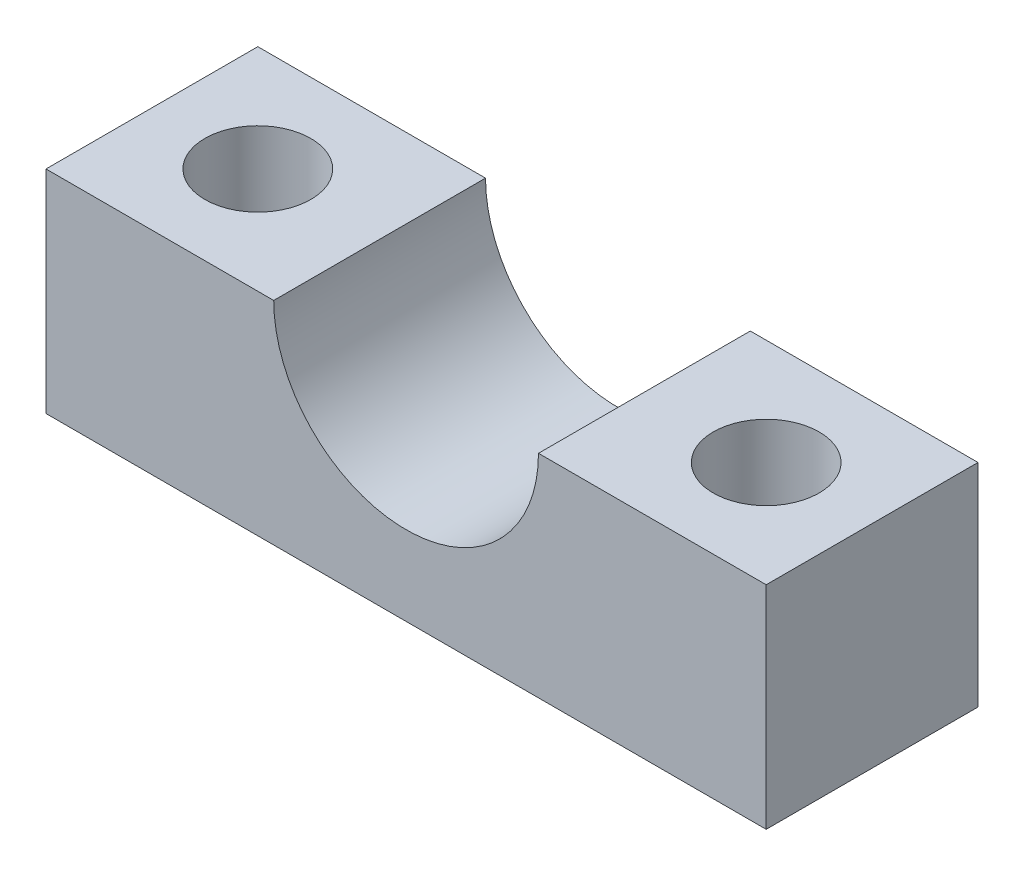
from build123d import *

# Parameters (mm, degrees)
SKETCH2_W           = 43.18
SKETCH2_H           = 12.7
SKETCH2_R           = 3.175
BOSS_EXTRUDE1_DEPTH = 12.7
SKETCH3_R           = 7.9375
CUT_EXTRUDE1_DEPTH  = 29.083947372


with BuildPart() as part:
    # Sketch2 → Boss-Extrude1 (new body)
    with BuildSketch(Plane(origin=(0, 0, 0), x_dir=(1, 0, 0), z_dir=(0, 1, 0))):
        Rectangle(SKETCH2_W, SKETCH2_H)
        with Locations(Location((-15.24, 0, 0), (0, 0, 270))):
            Circle(SKETCH2_R, mode=Mode.SUBTRACT)
        with Locations(Location((15.24, 0, 0), (0, 0, 90))):
            Circle(SKETCH2_R, mode=Mode.SUBTRACT)
    extrude(amount=BOSS_EXTRUDE1_DEPTH)

    # Sketch3 → Cut-Extrude1 (cut, through all)
    with BuildSketch(Plane.XY.offset(6.35)):
        with Locations((0, 12.7)):
            Circle(SKETCH3_R)
    extrude(amount=-CUT_EXTRUDE1_DEPTH, mode=Mode.SUBTRACT)


solid = part.part
